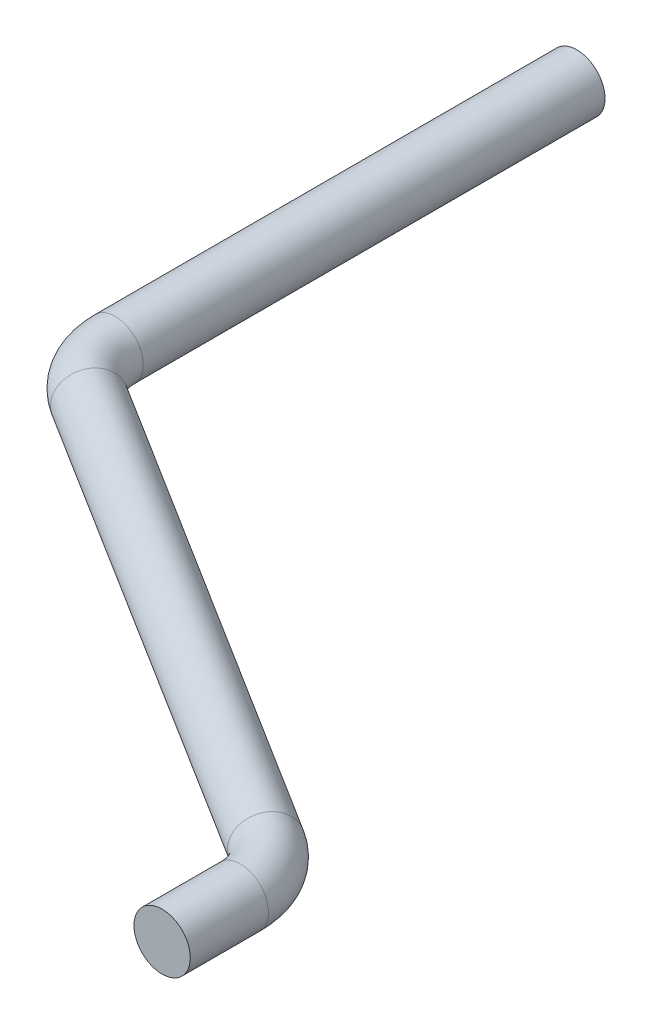
from build123d import *

# Parameters (mm, degrees)
BARRER1_PROFILE_R = 16.5


with BuildPart() as part:
    # Barrer1: sweep along a curve in space
    with BuildLine() as barrer1_path:
        Line((22.697859299, -725.488587031, 1717.535968933), (22.697859299, -725.488587031, 1671.728804253))
        ThreePointArc((22.697859299, -725.488587031, 1671.728804253), (17.68871557, -725.488587031, 1652.347370419), (3.915860427, -725.488587031, 1637.820155973))
        Line((3.915860427, -725.488587031, 1637.820155973), (-272.877823516, -725.488587031, 1464.619247176))
        ThreePointArc((-272.877823516, -725.488587031, 1464.619247176), (-286.650678659, -725.488587031, 1450.092032731), (-291.659822388, -725.488587031, 1430.710598897))
        Line((-291.659822388, -725.488587031, 1430.710598897), (-291.659822388, -725.488587031, 1160.310234708))
    # Barrer1 profile (on start of the path) → Barrer1 (sweep)
    with BuildSketch(Plane(origin=(22.697859299, -725.488587031, 1717.535968933), x_dir=(-1, 0, 0), z_dir=(0, 0, -1))):
        Circle(BARRER1_PROFILE_R)
    sweep(path=barrer1_path.line)


solid = part.part
